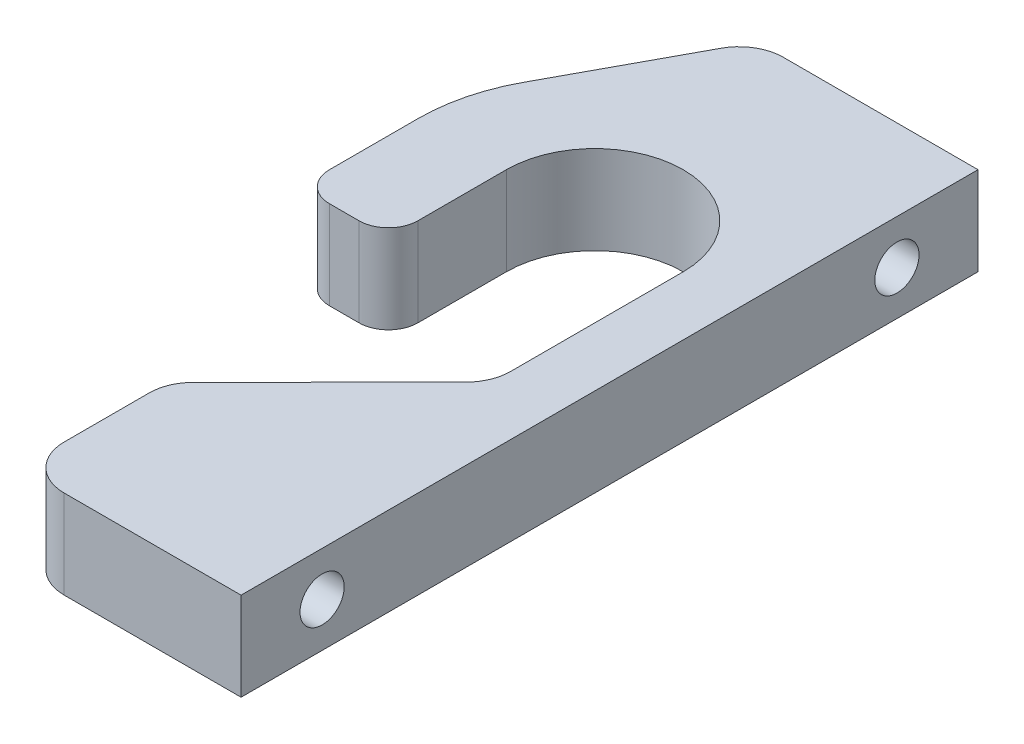
from build123d import *

# Parameters (mm, degrees)
BOSS_EXTRUDE1_DEPTH = 3
SKETCH2_R           = 1.5
CUT_EXTRUDE1_DEPTH  = 10
FILLET1_R           = 3
FILLET2_R           = 2


with BuildPart() as part:
    # Sketch1 → Boss-Extrude1 (new, symmetric)
    with BuildSketch(Plane(origin=(0, 0, 0), x_dir=(1, 0, 0), z_dir=(0, 1, 0))):
        with BuildLine():
            Line((6, 0), (6, -12.956788481))
            Line((6, -12.956788481), (-5, -24))
            Line((-5, -24), (-5, -34))
            Line((-5, -34), (10, -34))
            Line((10, -34), (10, 16))
            Line((10, 16), (-5, 16))
            Line((-5, 16), (-10.559794957, 5.700064076))
            ThreePointArc((-10.559794957, 5.700064076), (-11.634378786, 2.939596955), (-12, 0))
            Line((-12, 0), (-12, -8))
            Line((-12, -8), (-6, -8))
            Line((-6, -8), (-6, 0))
            ThreePointArc((-6, 0), (0, 6), (6, 0))
        make_face()
    extrude(amount=BOSS_EXTRUDE1_DEPTH, both=True)

    # Sketch2 → Cut-Extrude1 (cut)
    with BuildSketch(Plane(origin=(10, 0, 0), x_dir=(0, 0, -1), z_dir=(1, 0, 0))):
        with Locations((-28.5, 0)):
            Circle(SKETCH2_R)
        with Locations((10.5, 0)):
            Circle(SKETCH2_R)
    extrude(amount=-CUT_EXTRUDE1_DEPTH, mode=Mode.SUBTRACT)

    # Fillet1
    fillet1_edges = [part.edges().sort_by_distance(p)[0] for p in [
        (-5, 0, -16),
        (-5, 0, 34),
        (-5, 0, 24),
        (6, 0, 12.956788481),
    ]]
    fillet(fillet1_edges, radius=FILLET1_R)

    # Fillet2
    fillet2_edges = [part.edges().sort_by_distance(p)[0] for p in [
        (-6, 0, 8),
        (-12, 0, 8),
    ]]
    fillet(fillet2_edges, radius=FILLET2_R)


solid = part.part
